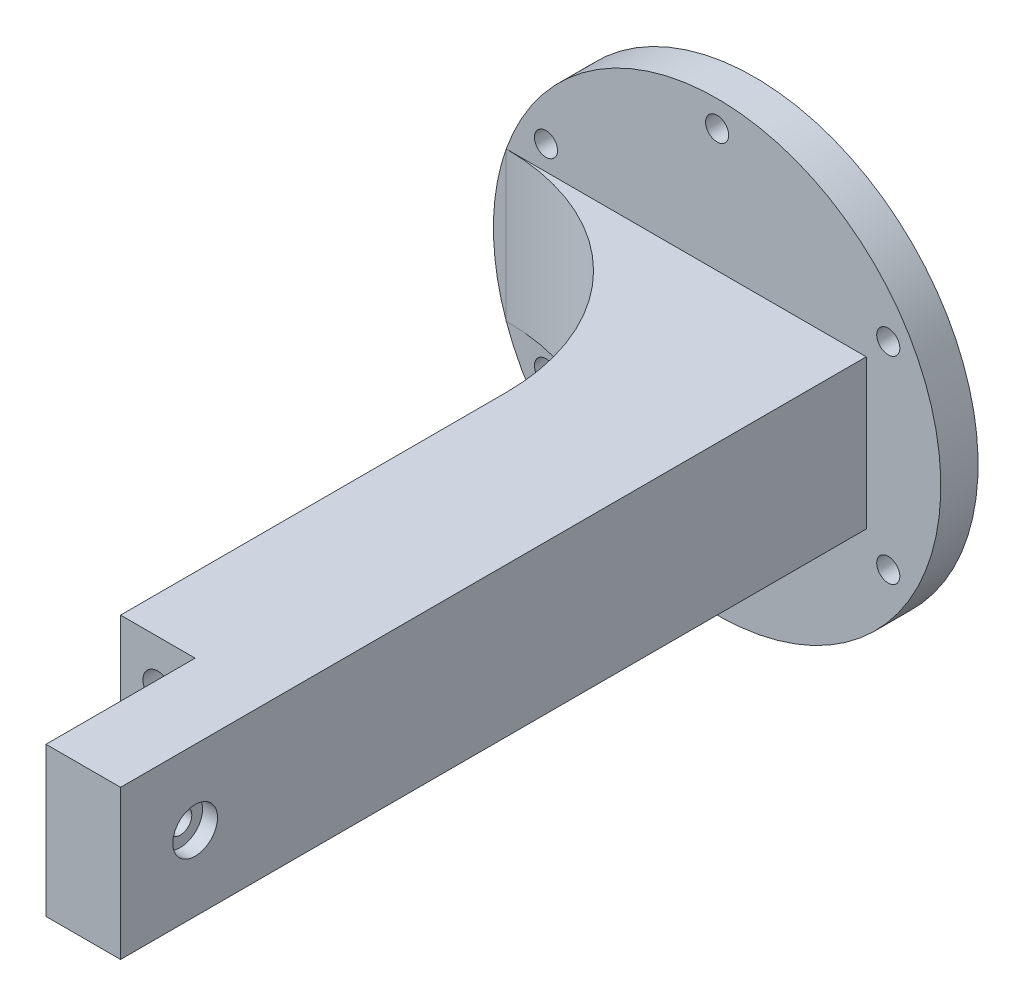
from build123d import *

# Parameters (mm, degrees)
SKETCH_1_W          = 20
SKETCH_1_H          = 20
EXTRUDE_1_DEPTH     = 140
SKETCH_2_R          = 30
SKETCH_2_R_2        = 1.55
EXTRUDE_2_DEPTH     = 5
SKETCH_3_W          = 28.284271248
SKETCH_3_H          = 20
EXTRUDE_3_DEPTH     = 28.28427125
CUT_EXTRUDE_1_DEPTH = 28.28427125
CUT_EXTRUDE_2_DEPTH = 28.28427125
CUT_EXTRUDE_3_DEPTH = 28.28427125
SKETCH_8_R          = 3
CUT_EXTRUDE_4_DEPTH = 2
SKETCH_9_R          = 2
CUT_EXTRUDE_5_DEPTH = 100
CUT_EXTRUDE_6_DEPTH = 3


with BuildPart() as part:
    # 草图1 → 凸台-拉伸1 (new body)
    with BuildSketch(Plane.XY):
        with Locations((-6.377546769, -6.820183169)):
            Rectangle(SKETCH_1_W, SKETCH_1_H)
    extrude(amount=EXTRUDE_1_DEPTH)

    # 草图2 → 凸台-拉伸2 (add)
    with BuildSketch(Plane(origin=(0, 0, 0), x_dir=(-1, 0, 0), z_dir=(0, 0, -1))):
        with Locations((16.377546769, -6.820183169)):
            Circle(SKETCH_2_R)
        with Locations((-6.572126431, 6.429816831)):
            Circle(SKETCH_2_R_2, mode=Mode.SUBTRACT)
        with Locations((16.377546769, 19.679816831)):
            Circle(SKETCH_2_R_2, mode=Mode.SUBTRACT)
        with Locations((39.32721997, 6.429816831)):
            Circle(SKETCH_2_R_2, mode=Mode.SUBTRACT)
        with Locations((39.32721997, -20.070183169)):
            Circle(SKETCH_2_R_2, mode=Mode.SUBTRACT)
        with Locations((16.377546769, -33.320183169)):
            Circle(SKETCH_2_R_2, mode=Mode.SUBTRACT)
        with Locations((-6.572126431, -20.070183169)):
            Circle(SKETCH_2_R_2, mode=Mode.SUBTRACT)
    extrude(amount=EXTRUDE_2_DEPTH)

    # 草图3 → 凸台-拉伸3 (add)
    with BuildSketch(Plane.XY):
        with Locations((-30.519682393, -6.820183169)):
            Rectangle(SKETCH_3_W, SKETCH_3_H)
    extrude(amount=EXTRUDE_3_DEPTH)

    # 草图4 → 切除-拉伸1 (cut)
    with BuildSketch(Plane(origin=(0, 3.179816831, 0), x_dir=(1, 0, 0), z_dir=(0, 1, 0))):
        with BuildLine():
            Line((-44.661818017, -3e-09), (-44.661818017, -28.28427125))
            Line((-44.661818017, -28.28427125), (-16.377546769, -28.28427125))
            ThreePointArc((-16.377546769, -28.28427125), (-24.661818017, -8.28427125), (-44.661818017, -3e-09))
        make_face()
    extrude(amount=-CUT_EXTRUDE_1_DEPTH, mode=Mode.SUBTRACT)

    # 草图6 → 切除-拉伸2 (cut)
    with BuildSketch(Plane(origin=(0, 3.179816831, 0), x_dir=(1, 0, 0), z_dir=(0, 1, 0))):
        Polygon((3.622453231, -140), (3.622453231, -100), (-6.377546769, -100), (-6.377546769, -80), (-16.377546769, -80), (-16.377546769, -100), (-16.377546769, -140), align=None)
    extrude(amount=-CUT_EXTRUDE_2_DEPTH, mode=Mode.SUBTRACT)

    # 草图7 → 切除-拉伸3 (cut)
    with BuildSketch(Plane.ZY.offset(6.377546769)):
        with BuildLine():
            ThreePointArc((91.55, -6.820183169), (90.59315932, -5.388169893), (88.903984489, -5.724167658))
            Line((88.903984489, -5.724167658), (91.096015511, -7.91619868))
            ThreePointArc((91.096015511, -7.91619868), (91.432013275, -7.413342489), (91.55, -6.820183169))
        make_face()
        with BuildLine():
            Line((91.096015511, -7.91619868), (88.903984489, -5.724167658))
            ThreePointArc((88.903984489, -5.724167658), (88.903984489, -7.91619868), (91.096015511, -7.91619868))
        make_face()
    extrude(amount=-CUT_EXTRUDE_3_DEPTH, mode=Mode.SUBTRACT)

    # 草图8 → 切除-拉伸4 (cut)
    with BuildSketch(Plane(origin=(3.622453231, 0, 0), x_dir=(0, 0, -1), z_dir=(1, 0, 0))):
        with Locations(Location((-90, -6.820183169, 0), (0, 0, 90))):
            Circle(SKETCH_8_R)
    extrude(amount=-CUT_EXTRUDE_4_DEPTH, mode=Mode.SUBTRACT)

    # 草图9 → 切除-拉伸5 (cut)
    with BuildSketch(Plane.XY.offset(80)):
        with Locations((-11.377546769, -2.820183169)):
            Circle(SKETCH_9_R)
    extrude(amount=-CUT_EXTRUDE_5_DEPTH, mode=Mode.SUBTRACT)

    # 草图10 → 切除-拉伸6 (cut)
    with BuildSketch(Plane(origin=(0, 0, -5), x_dir=(-1, 0, 0), z_dir=(0, 0, -1))):
        Polygon((16.377546769, -4.820183169), (48.333202205, -4.820183169), (48.333202205, -8.820183169), (16.377546769, -8.820183169), (10.220063838, -4.45167354), (11.377546769, -2.820183169), (12.810373312, -1.424830848), align=None)
    extrude(amount=-CUT_EXTRUDE_6_DEPTH, mode=Mode.SUBTRACT)


solid = part.part
